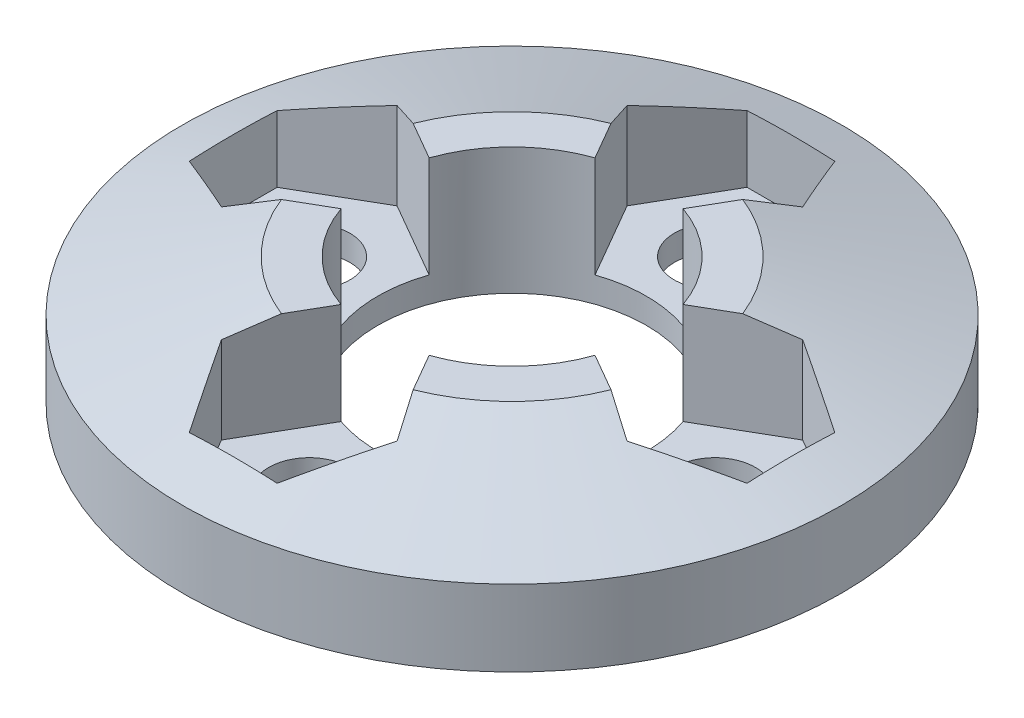
from build123d import *

# Parameters (mm, degrees)
CUT_EXTRUDE_1_DEPTH      = 4.5
CUT_EXTRUDE_1_DEPTH_BACK = 3.5
SKETCH_6_R               = 1.6
CUT_EXTRUDE_2_DEPTH      = 20.189841062
CUT_EXTRUDE_START        = 10
SKETCH_8_R               = 5.3
CUT_EXTRUDE_3_DEPTH      = 10


with BuildPart() as part:
    # 草图2 → 旋转1 (revolve)
    with BuildSketch(Plane.XY, mode=Mode.PRIVATE) as revolve_1_sk:
        Polygon((0, 0), (-13, 0), (-13, 3), (-7, 5), (-5.3, 5), (-5.3, 3), (0, 3), (0, 1.5), align=None)
    revolve(revolve_1_sk.sketch.rotate(Axis((0, 0, 0), (0, 1, 0)), 180), axis=Axis((0, 0, 0), (0, 1, 0)))

    # 草图5 → 切除-拉伸1 (cut, two sides: drawn at the far end of the back side and taken through both)
    with BuildSketch(Plane(origin=(0, 5.5, 0), x_dir=(-1, 0, 0), z_dir=(0, -1, 0)).offset(-CUT_EXTRUDE_1_DEPTH_BACK)):
        Polygon((8, -3.464101615), (11, -1.732050808), (11, 1.732050808), (8, 3.464101615), (5, 1.732050808), (5, -1.732050808), align=None)
        Polygon((3.464101615, 8), (1.732050808, 11), (-1.732050808, 11), (-3.464101615, 8), (-1.732050808, 5), (1.732050808, 5), align=None)
        Polygon((-3.464101615, -8), (-1.732050808, -11), (1.732050808, -11), (3.464101615, -8), (1.732050808, -5), (-1.732050808, -5), align=None)
        Polygon((-8, 3.464101615), (-11, 1.732050808), (-11, -1.732050808), (-8, -3.464101615), (-5, -1.732050808), (-5, 1.732050808), align=None)
    extrude(amount=CUT_EXTRUDE_1_DEPTH + CUT_EXTRUDE_1_DEPTH_BACK, mode=Mode.SUBTRACT)

    # 草图6 → 切除-拉伸2 (cut, through all)
    with BuildSketch(Plane(origin=(0, 5.5, 0), x_dir=(-1, 0, 0), z_dir=(0, -1, 0))):
        with Locations((0, 8)):
            Circle(SKETCH_6_R)
        with Locations((8, 0)):
            Circle(SKETCH_6_R)
        with Locations((0, -8)):
            Circle(SKETCH_6_R)
        with Locations((-8, 0)):
            Circle(SKETCH_6_R)
    extrude(amount=CUT_EXTRUDE_2_DEPTH, mode=Mode.SUBTRACT)

    # 草图8 → 切除-拉伸3 (cut)
    with BuildSketch(Plane(origin=(0, 5.5, 0), x_dir=(-1, 0, 0), z_dir=(0, -1, 0)).offset(CUT_EXTRUDE_START)):
        with Locations(Location((0, 0, 0), (0, 0, 160.875716495))):
            Circle(SKETCH_8_R)
    extrude(amount=-CUT_EXTRUDE_3_DEPTH, mode=Mode.SUBTRACT)


solid = part.part
